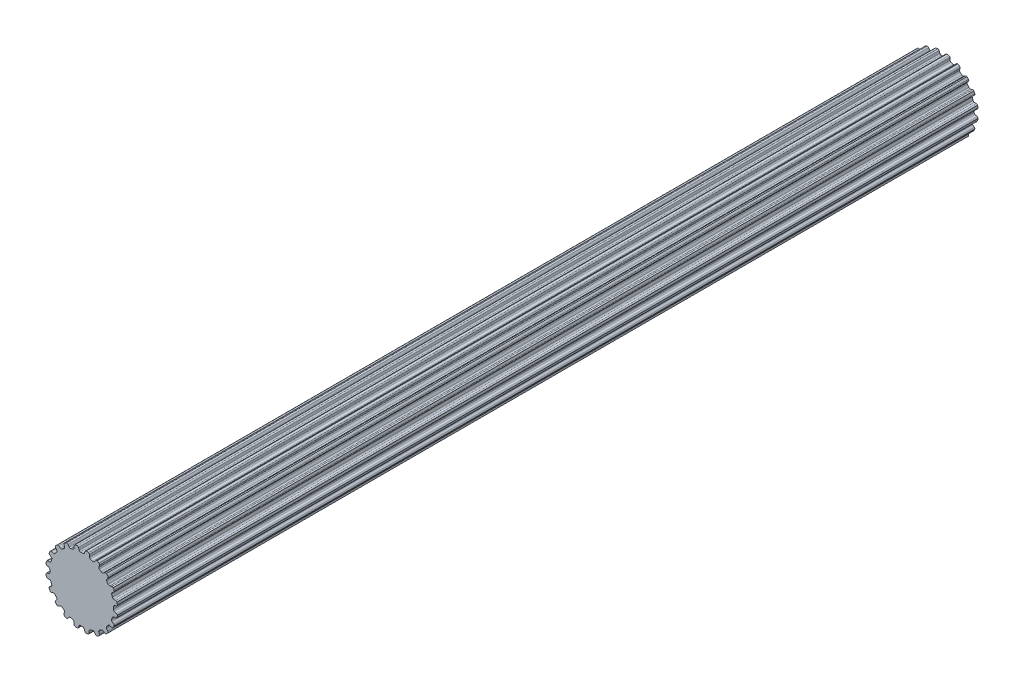
from build123d import *

# Parameters (mm, degrees)
BOSS_EXTRUDE1_DEPTH = 40.11549


with BuildPart() as part:
    # Sketch1 → Boss-Extrude1 (new, symmetric)
    with BuildSketch(Plane.XY):
        with BuildLine():
            Line((-0.106949245, 2.969874934), (0.106949245, 2.969874934))
            ThreePointArc((0.106949245, 2.969874934), (0.196343213, 2.986924176), (0.253739238, 3.057547504))
            Line((0.253739238, 3.057547504), (0.315888147, 3.237526941))
            ThreePointArc((0.315888147, 3.237526941), (0.359032156, 3.298322911), (0.4281449, 3.326269005))
            Line((0.4281449, 3.326269005), (0.620027588, 3.2937547))
            ThreePointArc((0.620027588, 3.2937547), (0.689621142, 3.24802576), (0.718272212, 3.169836791))
            Line((0.718272212, 3.169836791), (0.724389167, 2.979527391))
            ThreePointArc((0.724389167, 2.979527391), (0.750934762, 2.9040661), (0.816027049, 2.857568043))
            Line((0.816027049, 2.857568043), (1.019456602, 2.791469774))
            ThreePointArc((1.019456602, 2.791469774), (1.109743823, 2.780060312), (1.186154496, 2.829490741))
            Line((1.186154496, 2.829490741), (1.300878326, 2.981456288))
            ThreePointArc((1.300878326, 2.981456288), (1.360697704, 3.02594446), (1.435063648, 3.031165762))
            Line((1.435063648, 3.031165762), (1.607507455, 2.940947809))
            ThreePointArc((1.607507455, 2.940947809), (1.659563839, 2.875951412), (1.662650905, 2.792735615))
            Line((1.662650905, 2.792735615), (1.609659636, 2.609850378))
            ThreePointArc((1.609659636, 2.609850378), (1.611587176, 2.529879385), (1.659124931, 2.465542482))
            Line((1.659124931, 2.465542482), (1.832172444, 2.339816104))
            ThreePointArc((1.832172444, 2.339816104), (1.914514976, 2.301064775), (2.002460687, 2.32446371))
            Line((2.002460687, 2.32446371), (2.158529469, 2.433539921))
            ThreePointArc((2.158529469, 2.433539921), (2.229168681, 2.457365482), (2.301508367, 2.439350895))
            Line((2.301508367, 2.439350895), (2.437633293, 2.300260456))
            ThreePointArc((2.437633293, 2.300260456), (2.467056864, 2.222358901), (2.444277744, 2.14226202))
            Line((2.444277744, 2.14226202), (2.337365406, 1.984703026))
            ThreePointArc((2.337365406, 1.984703026), (2.314486209, 1.908050449), (2.339816104, 1.832172444))
            Line((2.339816104, 1.832172444), (2.465542482, 1.659124931))
            ThreePointArc((2.465542482, 1.659124931), (2.531880064, 1.596824985), (2.622752074, 1.591901975))
            Line((2.622752074, 1.591901975), (2.804888709, 1.64741171))
            ThreePointArc((2.804888709, 1.64741171), (2.879433095, 1.648242449), (2.942665411, 1.608755366))
            Line((2.942665411, 1.608755366), (3.0291466, 1.434407582))
            ThreePointArc((3.0291466, 1.434407582), (3.033057175, 1.351226417), (2.986641646, 1.282088892))
            Line((2.986641646, 1.282088892), (2.836273564, 1.165279113))
            ThreePointArc((2.836273564, 1.165279113), (2.790827206, 1.099448241), (2.791469774, 1.019456602))
            Line((2.791469774, 1.019456602), (2.857568043, 0.816027049))
            ThreePointArc((2.857568043, 0.816027049), (2.901407091, 0.736276839), (2.986310214, 0.703513784))
            Line((2.986310214, 0.703513784), (3.1766859, 0.700023363))
            ThreePointArc((3.1766859, 0.700023363), (3.247838536, 0.677777961), (3.295773863, 0.620683653))
            Line((3.295773863, 0.620683653), (3.324145932, 0.4281449))
            ThreePointArc((3.324145932, 0.4281449), (3.302160717, 0.347826477), (3.236652255, 0.29641597))
            Line((3.236652255, 0.29641597), (3.057547504, 0.231789562))
            ThreePointArc((3.057547504, 0.231789562), (2.993982591, 0.183224379), (2.969874934, 0.106949245))
            Line((2.969874934, 0.106949245), (2.969874934, -0.106949245))
            ThreePointArc((2.969874934, -0.106949245), (2.986924176, -0.196343213), (3.057547504, -0.253739238))
            Line((3.057547504, -0.253739238), (3.237526941, -0.315888147))
            ThreePointArc((3.237526941, -0.315888147), (3.298322911, -0.359032156), (3.326269005, -0.4281449))
            Line((3.326269005, -0.4281449), (3.2937547, -0.620027588))
            ThreePointArc((3.2937547, -0.620027588), (3.24802576, -0.689621142), (3.169836791, -0.718272212))
            Line((3.169836791, -0.718272212), (2.979527391, -0.724389167))
            ThreePointArc((2.979527391, -0.724389167), (2.9040661, -0.750934762), (2.857568043, -0.816027049))
            Line((2.857568043, -0.816027049), (2.791469774, -1.019456602))
            ThreePointArc((2.791469774, -1.019456602), (2.780060312, -1.109743823), (2.829490741, -1.186154496))
            Line((2.829490741, -1.186154496), (2.981456288, -1.300878326))
            ThreePointArc((2.981456288, -1.300878326), (3.02594446, -1.360697704), (3.031165762, -1.435063648))
            Line((3.031165762, -1.435063648), (2.940947809, -1.607507455))
            ThreePointArc((2.940947809, -1.607507455), (2.875951412, -1.659563839), (2.792735615, -1.662650905))
            Line((2.792735615, -1.662650905), (2.609850378, -1.609659636))
            ThreePointArc((2.609850378, -1.609659636), (2.529879385, -1.611587176), (2.465542482, -1.659124931))
            Line((2.465542482, -1.659124931), (2.339816104, -1.832172444))
            ThreePointArc((2.339816104, -1.832172444), (2.301064775, -1.914514976), (2.32446371, -2.002460687))
            Line((2.32446371, -2.002460687), (2.433539921, -2.158529469))
            ThreePointArc((2.433539921, -2.158529469), (2.457365482, -2.229168681), (2.439350895, -2.301508367))
            Line((2.439350895, -2.301508367), (2.300260456, -2.437633293))
            ThreePointArc((2.300260456, -2.437633293), (2.222358901, -2.467056864), (2.14226202, -2.444277744))
            Line((2.14226202, -2.444277744), (1.984703026, -2.337365406))
            ThreePointArc((1.984703026, -2.337365406), (1.908050449, -2.314486209), (1.832172444, -2.339816104))
            Line((1.832172444, -2.339816104), (1.659124931, -2.465542482))
            ThreePointArc((1.659124931, -2.465542482), (1.596824985, -2.531880064), (1.591901975, -2.622752074))
            Line((1.591901975, -2.622752074), (1.64741171, -2.804888709))
            ThreePointArc((1.64741171, -2.804888709), (1.648242449, -2.879433095), (1.608755366, -2.942665411))
            Line((1.608755366, -2.942665411), (1.434407582, -3.0291466))
            ThreePointArc((1.434407582, -3.0291466), (1.351226417, -3.033057175), (1.282088892, -2.986641646))
            Line((1.282088892, -2.986641646), (1.165279113, -2.836273564))
            ThreePointArc((1.165279113, -2.836273564), (1.099448241, -2.790827206), (1.019456602, -2.791469774))
            Line((1.019456602, -2.791469774), (0.816027049, -2.857568043))
            ThreePointArc((0.816027049, -2.857568043), (0.736276839, -2.901407091), (0.703513784, -2.986310214))
            Line((0.703513784, -2.986310214), (0.700023363, -3.1766859))
            ThreePointArc((0.700023363, -3.1766859), (0.677777961, -3.247838536), (0.620683653, -3.295773863))
            Line((0.620683653, -3.295773863), (0.4281449, -3.324145932))
            ThreePointArc((0.4281449, -3.324145932), (0.347826477, -3.302160717), (0.29641597, -3.236652255))
            Line((0.29641597, -3.236652255), (0.231789562, -3.057547504))
            ThreePointArc((0.231789562, -3.057547504), (0.183224379, -2.993982591), (0.106949245, -2.969874934))
            Line((0.106949245, -2.969874934), (-0.106949245, -2.969874934))
            ThreePointArc((-0.106949245, -2.969874934), (-0.196343213, -2.986924176), (-0.253739238, -3.057547504))
            Line((-0.253739238, -3.057547504), (-0.315888147, -3.237526941))
            ThreePointArc((-0.315888147, -3.237526941), (-0.359032156, -3.298322911), (-0.4281449, -3.326269005))
            Line((-0.4281449, -3.326269005), (-0.620027588, -3.2937547))
            ThreePointArc((-0.620027588, -3.2937547), (-0.689621142, -3.24802576), (-0.718272212, -3.169836791))
            Line((-0.718272212, -3.169836791), (-0.724389167, -2.979527391))
            ThreePointArc((-0.724389167, -2.979527391), (-0.750934762, -2.9040661), (-0.816027049, -2.857568043))
            Line((-0.816027049, -2.857568043), (-1.019456602, -2.791469774))
            ThreePointArc((-1.019456602, -2.791469774), (-1.109743823, -2.780060312), (-1.186154496, -2.829490741))
            Line((-1.186154496, -2.829490741), (-1.300878326, -2.981456288))
            ThreePointArc((-1.300878326, -2.981456288), (-1.360697704, -3.02594446), (-1.435063648, -3.031165762))
            Line((-1.435063648, -3.031165762), (-1.607507455, -2.940947809))
            ThreePointArc((-1.607507455, -2.940947809), (-1.659563839, -2.875951412), (-1.662650905, -2.792735615))
            Line((-1.662650905, -2.792735615), (-1.609659636, -2.609850378))
            ThreePointArc((-1.609659636, -2.609850378), (-1.611587176, -2.529879385), (-1.659124931, -2.465542482))
            Line((-1.659124931, -2.465542482), (-1.832172444, -2.339816104))
            ThreePointArc((-1.832172444, -2.339816104), (-1.914514976, -2.301064775), (-2.002460687, -2.32446371))
            Line((-2.002460687, -2.32446371), (-2.158529469, -2.433539921))
            ThreePointArc((-2.158529469, -2.433539921), (-2.229168681, -2.457365482), (-2.301508367, -2.439350895))
            Line((-2.301508367, -2.439350895), (-2.437633293, -2.300260456))
            ThreePointArc((-2.437633293, -2.300260456), (-2.467056864, -2.222358901), (-2.444277744, -2.14226202))
            Line((-2.444277744, -2.14226202), (-2.337365406, -1.984703026))
            ThreePointArc((-2.337365406, -1.984703026), (-2.314486209, -1.908050449), (-2.339816104, -1.832172444))
            Line((-2.339816104, -1.832172444), (-2.465542482, -1.659124931))
            ThreePointArc((-2.465542482, -1.659124931), (-2.531880064, -1.596824985), (-2.622752074, -1.591901975))
            Line((-2.622752074, -1.591901975), (-2.804888709, -1.64741171))
            ThreePointArc((-2.804888709, -1.64741171), (-2.879433095, -1.648242449), (-2.942665411, -1.608755366))
            Line((-2.942665411, -1.608755366), (-3.0291466, -1.434407582))
            ThreePointArc((-3.0291466, -1.434407582), (-3.033057175, -1.351226417), (-2.986641646, -1.282088892))
            Line((-2.986641646, -1.282088892), (-2.836273564, -1.165279113))
            ThreePointArc((-2.836273564, -1.165279113), (-2.790827206, -1.099448241), (-2.791469774, -1.019456602))
            Line((-2.791469774, -1.019456602), (-2.857568043, -0.816027049))
            ThreePointArc((-2.857568043, -0.816027049), (-2.901407091, -0.736276839), (-2.986310214, -0.703513784))
            Line((-2.986310214, -0.703513784), (-3.1766859, -0.700023363))
            ThreePointArc((-3.1766859, -0.700023363), (-3.247838536, -0.677777961), (-3.295773863, -0.620683653))
            Line((-3.295773863, -0.620683653), (-3.324145932, -0.4281449))
            ThreePointArc((-3.324145932, -0.4281449), (-3.302160717, -0.347826477), (-3.236652255, -0.29641597))
            Line((-3.236652255, -0.29641597), (-3.057547504, -0.231789562))
            ThreePointArc((-3.057547504, -0.231789562), (-2.993982591, -0.183224379), (-2.969874934, -0.106949245))
            Line((-2.969874934, -0.106949245), (-2.969874934, 0.106949245))
            ThreePointArc((-2.969874934, 0.106949245), (-2.986924176, 0.196343213), (-3.057547504, 0.253739238))
            Line((-3.057547504, 0.253739238), (-3.237526941, 0.315888147))
            ThreePointArc((-3.237526941, 0.315888147), (-3.298322911, 0.359032156), (-3.326269005, 0.4281449))
            Line((-3.326269005, 0.4281449), (-3.2937547, 0.620027588))
            ThreePointArc((-3.2937547, 0.620027588), (-3.24802576, 0.689621142), (-3.169836791, 0.718272212))
            Line((-3.169836791, 0.718272212), (-2.979527391, 0.724389167))
            ThreePointArc((-2.979527391, 0.724389167), (-2.9040661, 0.750934762), (-2.857568043, 0.816027049))
            Line((-2.857568043, 0.816027049), (-2.791469774, 1.019456602))
            ThreePointArc((-2.791469774, 1.019456602), (-2.780060312, 1.109743823), (-2.829490741, 1.186154496))
            Line((-2.829490741, 1.186154496), (-2.981456288, 1.300878326))
            ThreePointArc((-2.981456288, 1.300878326), (-3.02594446, 1.360697704), (-3.031165762, 1.435063648))
            Line((-3.031165762, 1.435063648), (-2.940947809, 1.607507455))
            ThreePointArc((-2.940947809, 1.607507455), (-2.875951412, 1.659563839), (-2.792735615, 1.662650905))
            Line((-2.792735615, 1.662650905), (-2.609850378, 1.609659636))
            ThreePointArc((-2.609850378, 1.609659636), (-2.529879385, 1.611587176), (-2.465542482, 1.659124931))
            Line((-2.465542482, 1.659124931), (-2.339816104, 1.832172444))
            ThreePointArc((-2.339816104, 1.832172444), (-2.301064775, 1.914514976), (-2.32446371, 2.002460687))
            Line((-2.32446371, 2.002460687), (-2.433539921, 2.158529469))
            ThreePointArc((-2.433539921, 2.158529469), (-2.457365482, 2.229168681), (-2.439350895, 2.301508367))
            Line((-2.439350895, 2.301508367), (-2.300260456, 2.437633293))
            ThreePointArc((-2.300260456, 2.437633293), (-2.222358901, 2.467056864), (-2.14226202, 2.444277744))
            Line((-2.14226202, 2.444277744), (-1.984703026, 2.337365406))
            ThreePointArc((-1.984703026, 2.337365406), (-1.908050449, 2.314486209), (-1.832172444, 2.339816104))
            Line((-1.832172444, 2.339816104), (-1.659124931, 2.465542482))
            ThreePointArc((-1.659124931, 2.465542482), (-1.596824985, 2.531880064), (-1.591901975, 2.622752074))
            Line((-1.591901975, 2.622752074), (-1.64741171, 2.804888709))
            ThreePointArc((-1.64741171, 2.804888709), (-1.648242449, 2.879433095), (-1.608755366, 2.942665411))
            Line((-1.608755366, 2.942665411), (-1.434407582, 3.0291466))
            ThreePointArc((-1.434407582, 3.0291466), (-1.351226417, 3.033057175), (-1.282088892, 2.986641646))
            Line((-1.282088892, 2.986641646), (-1.165279113, 2.836273564))
            ThreePointArc((-1.165279113, 2.836273564), (-1.099448241, 2.790827206), (-1.019456602, 2.791469774))
            Line((-1.019456602, 2.791469774), (-0.816027049, 2.857568043))
            ThreePointArc((-0.816027049, 2.857568043), (-0.736276839, 2.901407091), (-0.703513784, 2.986310214))
            Line((-0.703513784, 2.986310214), (-0.700023363, 3.1766859))
            ThreePointArc((-0.700023363, 3.1766859), (-0.677777961, 3.247838536), (-0.620683653, 3.295773863))
            Line((-0.620683653, 3.295773863), (-0.4281449, 3.324145932))
            ThreePointArc((-0.4281449, 3.324145932), (-0.347826477, 3.302160717), (-0.29641597, 3.236652255))
            Line((-0.29641597, 3.236652255), (-0.231789562, 3.057547504))
            ThreePointArc((-0.231789562, 3.057547504), (-0.183224379, 2.993982591), (-0.106949245, 2.969874934))
        make_face()
    extrude(amount=BOSS_EXTRUDE1_DEPTH, both=True)


solid = part.part
